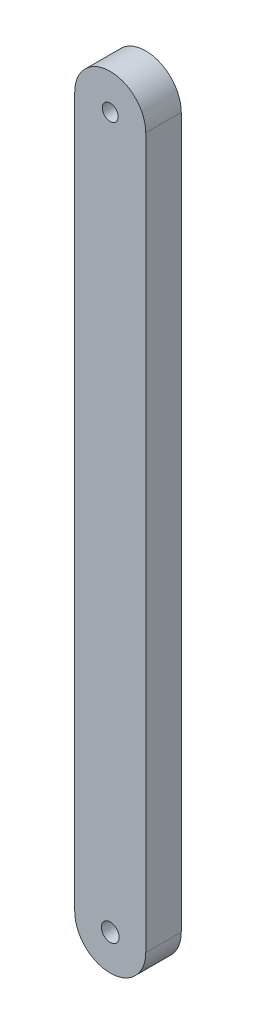
from build123d import *

# Parameters (mm, degrees)
SKETCH1_R             = 2.24506403
SKETCH1_R_2           = 2.5
BOSS_EXTRUDE1_DEPTH   = 10
BODY_MOVE_COPY1_ANGLE = 90


with BuildPart() as part:
    # Sketch1 → Boss-Extrude1 (new body)
    with BuildSketch(Plane(origin=(0, 0, 0), x_dir=(1, 0, 0), z_dir=(0, 1, 0))):
        with BuildLine():
            ThreePointArc((10, -100), (0, -110), (-10, -100))
            Line((-10, -100), (-10, 100))
            ThreePointArc((-10, 100), (0, 110), (10, 100))
            Line((10, 100), (10, -100))
        make_face()
        with Locations(Location((0, 100, 0), (0, 0, 270))):
            Circle(SKETCH1_R, mode=Mode.SUBTRACT)
        with Locations(Location((0, -100, 0), (0, 0, 270))):
            Circle(SKETCH1_R_2, mode=Mode.SUBTRACT)
    extrude(amount=BOSS_EXTRUDE1_DEPTH)


with BuildPart() as part_1:
    # Body-Move/Copy1: moved
    add(part.part.rotate(Axis((0, 5, 0), (1, 0, 0)), BODY_MOVE_COPY1_ANGLE))


with BuildPart() as part_2:
    # Body-Move/Copy2: moved
    add(part_1.part.moved(Location((0, -105, 0))))


solid = part_2.part
